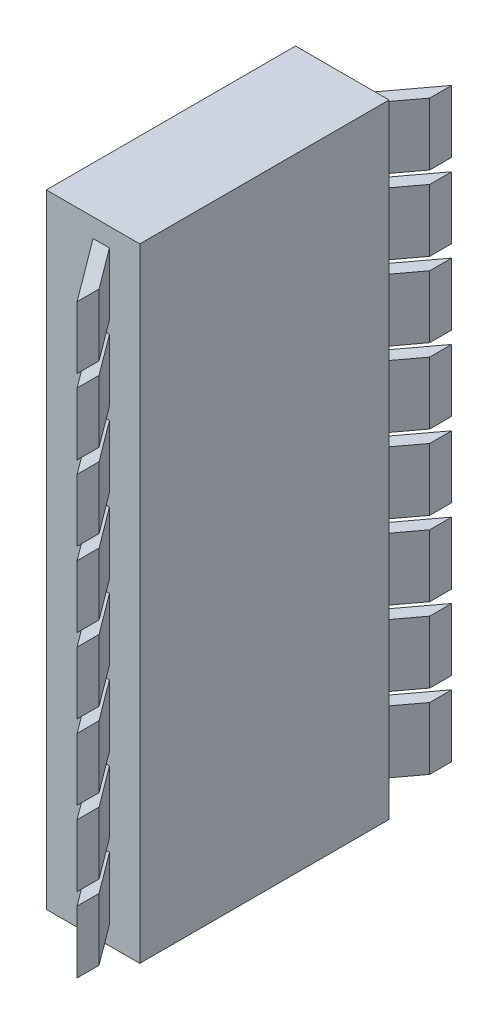
from build123d import *

# Parameters (mm, degrees)
SKETCH_1_W             = 4
SKETCH_1_H             = 10
EXTRUDE_1_DEPTH        = 1.5
EXTRUDE_2_DEPTH        = 1
PATTERN_LINEAR_1_COUNT = 8
PATTERN_LINEAR_1_PITCH = 1.2
MIRROR_1_COPY_1_DEPTH  = 1
MIRROR_1_COPY_2_DEPTH  = 1
MIRROR_1_COPY_3_DEPTH  = 1
MIRROR_1_COPY_4_DEPTH  = 1
MIRROR_1_COPY_5_DEPTH  = 1
MIRROR_1_COPY_6_DEPTH  = 1
MIRROR_1_COPY_7_DEPTH  = 1


with BuildPart() as part:
    # 草图1 → 凸台-拉伸1 (new body)
    with BuildSketch(Plane(origin=(0, 0, 0), x_dir=(0, 0, -1), z_dir=(1, 0, 0))):
        Rectangle(SKETCH_1_W, SKETCH_1_H)
    extrude(amount=EXTRUDE_1_DEPTH)

    # 草图2 → 凸台-拉伸2 (add)
    with BuildSketch(Plane(origin=(0, -4.7, 0), x_dir=(-1, 0, 0), z_dir=(0, -1, 0))):
        Polygon((-0.75, 2), (-1.5, 3.005587043), (-1.5, 2.65324469), (-1.012788554, 2), align=None)
    extrude_2 = extrude(amount=-EXTRUDE_2_DEPTH)

    # 阵列(线性)1: 凸台-拉伸2 ×8
    with Locations(*[(0, i * PATTERN_LINEAR_1_PITCH, 0) for i in range(1, PATTERN_LINEAR_1_COUNT)]):
        add(extrude_2)

    # 镜向1: 凸台-拉伸2 across plane
    add(extrude_2.mirror(Plane.XY))

    # 镜向1 copy 1 sketch → 镜向1 copy 1 (add)
    with BuildSketch(Plane(origin=(0, -3.5, 0), x_dir=(-1, 0, 0), z_dir=(0, -1, 0))):
        Polygon((-0.75, -2), (-1.5, -3.005587043), (-1.5, -2.65324469), (-1.012788554, -2), align=None)
    extrude(amount=-MIRROR_1_COPY_1_DEPTH)

    # 镜向1 copy 2 sketch → 镜向1 copy 2 (add)
    with BuildSketch(Plane(origin=(0, -2.3, 0), x_dir=(-1, 0, 0), z_dir=(0, -1, 0))):
        Polygon((-0.75, -2), (-1.5, -3.005587043), (-1.5, -2.65324469), (-1.012788554, -2), align=None)
    extrude(amount=-MIRROR_1_COPY_2_DEPTH)

    # 镜向1 copy 3 sketch → 镜向1 copy 3 (add)
    with BuildSketch(Plane(origin=(0, -1.1, 0), x_dir=(-1, 0, 0), z_dir=(0, -1, 0))):
        Polygon((-0.75, -2), (-1.5, -3.005587043), (-1.5, -2.65324469), (-1.012788554, -2), align=None)
    extrude(amount=-MIRROR_1_COPY_3_DEPTH)

    # 镜向1 copy 4 sketch → 镜向1 copy 4 (add)
    with BuildSketch(Plane(origin=(0, 0.1, 0), x_dir=(-1, 0, 0), z_dir=(0, -1, 0))):
        Polygon((-0.75, -2), (-1.5, -3.005587043), (-1.5, -2.65324469), (-1.012788554, -2), align=None)
    extrude(amount=-MIRROR_1_COPY_4_DEPTH)

    # 镜向1 copy 5 sketch → 镜向1 copy 5 (add)
    with BuildSketch(Plane(origin=(0, 1.3, 0), x_dir=(-1, 0, 0), z_dir=(0, -1, 0))):
        Polygon((-0.75, -2), (-1.5, -3.005587043), (-1.5, -2.65324469), (-1.012788554, -2), align=None)
    extrude(amount=-MIRROR_1_COPY_5_DEPTH)

    # 镜向1 copy 6 sketch → 镜向1 copy 6 (add)
    with BuildSketch(Plane(origin=(0, 2.5, 0), x_dir=(-1, 0, 0), z_dir=(0, -1, 0))):
        Polygon((-0.75, -2), (-1.5, -3.005587043), (-1.5, -2.65324469), (-1.012788554, -2), align=None)
    extrude(amount=-MIRROR_1_COPY_6_DEPTH)

    # 镜向1 copy 7 sketch → 镜向1 copy 7 (add)
    with BuildSketch(Plane(origin=(0, 3.7, 0), x_dir=(-1, 0, 0), z_dir=(0, -1, 0))):
        Polygon((-0.75, -2), (-1.5, -3.005587043), (-1.5, -2.65324469), (-1.012788554, -2), align=None)
    extrude(amount=-MIRROR_1_COPY_7_DEPTH)


solid = part.part
